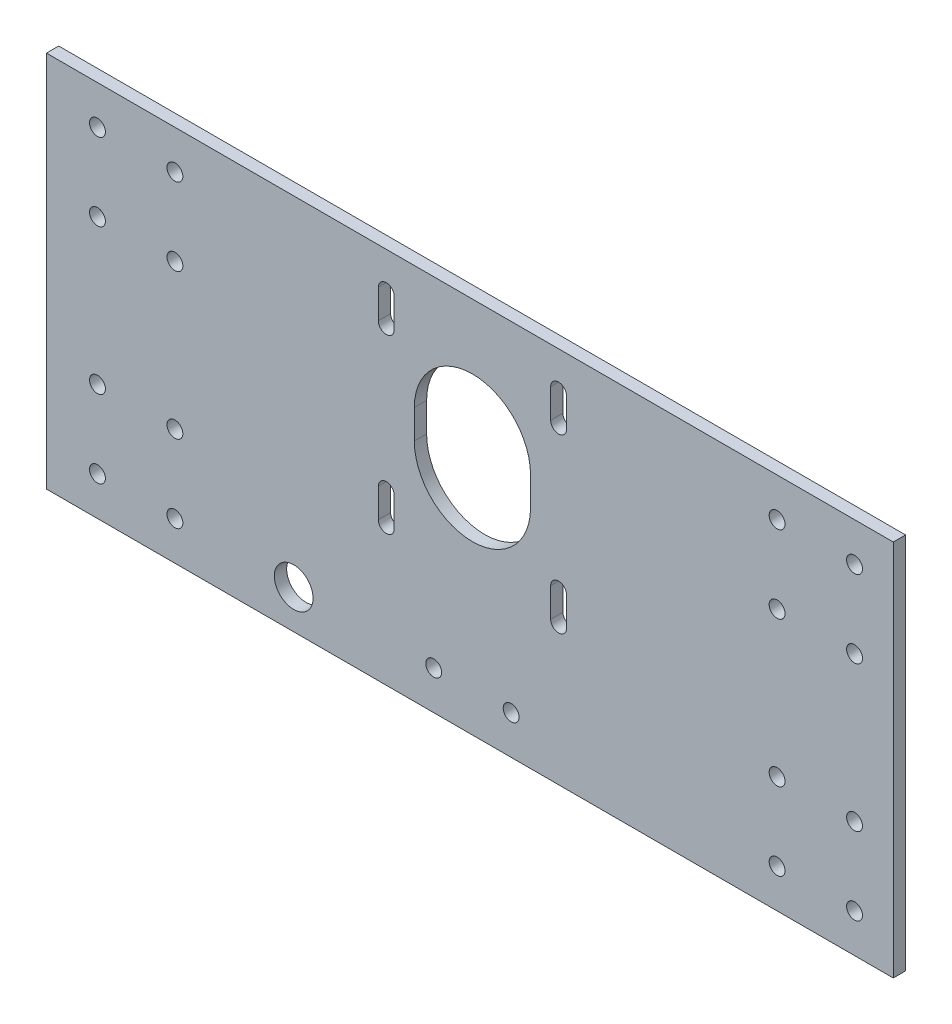
from build123d import *

# Parameters (mm, degrees)
SKETCH1_W           = 437.35
SKETCH1_H           = 195
SKETCH1_R           = 4.1
SKETCH1_R_2         = 10
BOSS_EXTRUDE1_DEPTH = 6.35


with BuildPart() as part:
    # Sketch1 → Boss-Extrude1 (new body)
    with BuildSketch(Plane.XY):
        with Locations((-1.325, -19)):
            Rectangle(SKETCH1_W, SKETCH1_H)
        with Locations((-193.65, 58.5)):
            Circle(SKETCH1_R, mode=Mode.SUBTRACT)
        with Locations((-153.65, 58.5)):
            Circle(SKETCH1_R, mode=Mode.SUBTRACT)
        with Locations((-153.65, 18.5)):
            Circle(SKETCH1_R, mode=Mode.SUBTRACT)
        with Locations((-193.65, 18.5)):
            Circle(SKETCH1_R, mode=Mode.SUBTRACT)
        with Locations((-193.65, -56.5)):
            Circle(SKETCH1_R, mode=Mode.SUBTRACT)
        with Locations((-153.65, -56.5)):
            Circle(SKETCH1_R, mode=Mode.SUBTRACT)
        with Locations((-153.65, -96.5)):
            Circle(SKETCH1_R, mode=Mode.SUBTRACT)
        with Locations((-193.65, -96.5)):
            Circle(SKETCH1_R, mode=Mode.SUBTRACT)
        with Locations((157.35, -56.5)):
            Circle(SKETCH1_R, mode=Mode.SUBTRACT)
        with Locations((197.35, -56.5)):
            Circle(SKETCH1_R, mode=Mode.SUBTRACT)
        with Locations((197.35, -96.5)):
            Circle(SKETCH1_R, mode=Mode.SUBTRACT)
        with Locations((157.35, -96.5)):
            Circle(SKETCH1_R, mode=Mode.SUBTRACT)
        with Locations((157.35, 18.5)):
            Circle(SKETCH1_R, mode=Mode.SUBTRACT)
        with Locations((197.35, 18.5)):
            Circle(SKETCH1_R, mode=Mode.SUBTRACT)
        with Locations((197.35, 58.5)):
            Circle(SKETCH1_R, mode=Mode.SUBTRACT)
        with Locations((157.35, 58.5)):
            Circle(SKETCH1_R, mode=Mode.SUBTRACT)
        with Locations((-92.3, -96.5)):
            Circle(SKETCH1_R_2, mode=Mode.SUBTRACT)
        with Locations((-20, -96.5)):
            Circle(SKETCH1_R, mode=Mode.SUBTRACT)
        with Locations((20, -96.5)):
            Circle(SKETCH1_R, mode=Mode.SUBTRACT)
        with BuildLine():
            Line((-48.6, -44.5), (-48.6, -29.5))
            ThreePointArc((-48.6, -29.5), (-44.5, -25.4), (-40.4, -29.5))
            Line((-40.4, -29.5), (-40.4, -44.5))
            ThreePointArc((-40.4, -44.5), (-44.5, -48.6), (-48.6, -44.5))
        make_face(mode=Mode.SUBTRACT)
        with BuildLine():
            Line((-48.6, 44.5), (-48.6, 59.5))
            ThreePointArc((-48.6, 59.5), (-44.5, 63.6), (-40.4, 59.5))
            Line((-40.4, 59.5), (-40.4, 44.5))
            ThreePointArc((-40.4, 44.5), (-44.5, 40.4), (-48.6, 44.5))
        make_face(mode=Mode.SUBTRACT)
        with BuildLine():
            Line((40.4, 44.5), (40.4, 59.5))
            ThreePointArc((40.4, 59.5), (44.5, 63.6), (48.6, 59.5))
            Line((48.6, 59.5), (48.6, 44.5))
            ThreePointArc((48.6, 44.5), (44.5, 40.4), (40.4, 44.5))
        make_face(mode=Mode.SUBTRACT)
        with BuildLine():
            Line((40.4, -44.5), (40.4, -29.5))
            ThreePointArc((40.4, -29.5), (44.5, -25.4), (48.6, -29.5))
            Line((48.6, -29.5), (48.6, -44.5))
            ThreePointArc((48.6, -44.5), (44.5, -48.6), (40.4, -44.5))
        make_face(mode=Mode.SUBTRACT)
        with BuildLine():
            Line((-30, 0), (-30, 15))
            ThreePointArc((-30, 15), (0, 45), (30, 15))
            Line((30, 15), (30, 0))
            ThreePointArc((30, 0), (0, -30), (-30, 0))
        make_face(mode=Mode.SUBTRACT)
    extrude(amount=BOSS_EXTRUDE1_DEPTH)


solid = part.part
